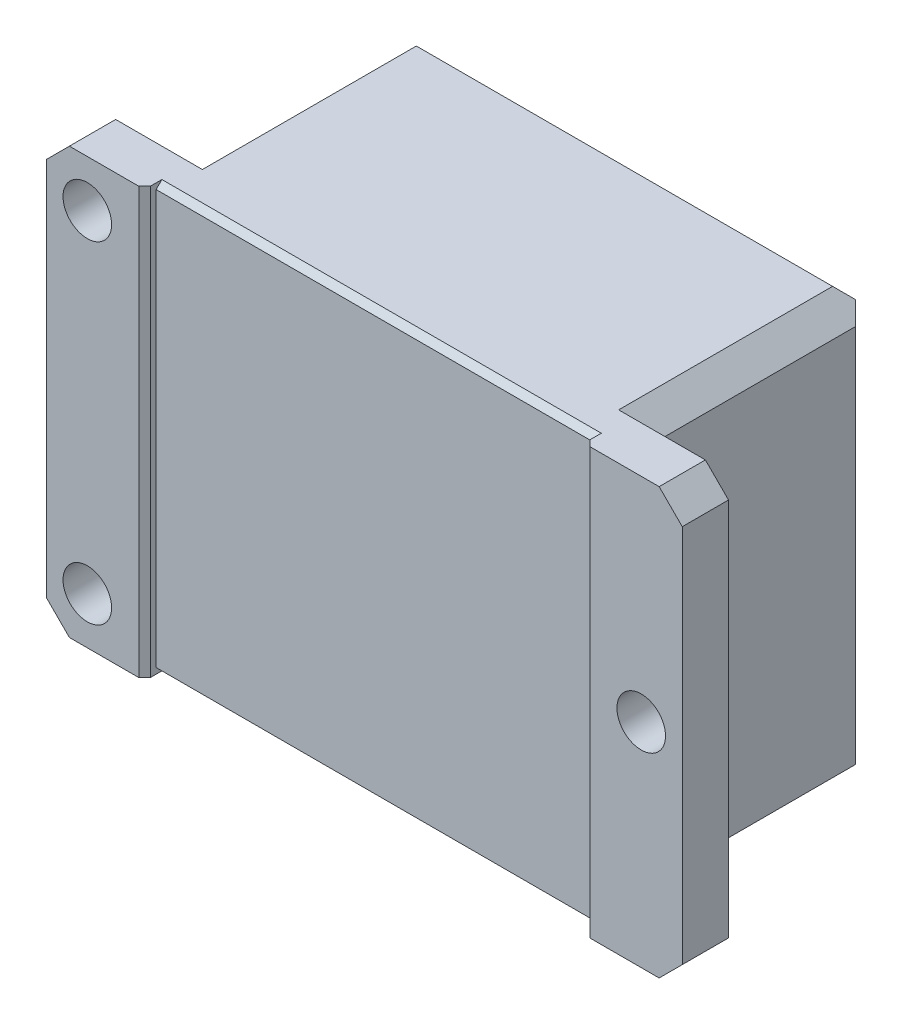
from build123d import *

# Parameters (mm, degrees)
SKETCH_1_W          = 55
SKETCH_1_H          = 36.8
EXTRUDE_1_DEPTH     = 24
SKETCH_2_W          = 38
SKETCH_2_H          = 36.8
CUT_EXTRUDE_1_DEPTH = 1
CHAMFER_1_SIZE      = 0.5
CHAMFER_2_SIZE      = 0.5
SKETCH_3_W          = 7.5
SKETCH_3_H          = 36.8
CUT_EXTRUDE_2_DEPTH = 20
CHAMFER_3_SIZE      = 1.5
CHAMFER_4_SIZE      = 2
CHAMFER_5_SIZE      = 2
SKETCH_4_R          = 2.1
CUT_EXTRUDE_3_DEPTH = 20
SKETCH_5_R          = 5
EXTRUDE_2_DEPTH     = 10


with BuildPart() as part:
    # 草图1 → 凸台-拉伸1 (new body)
    with BuildSketch(Plane.XY):
        with Locations((-27.5, 18.4)):
            Rectangle(SKETCH_1_W, SKETCH_1_H)
    extrude(amount=EXTRUDE_1_DEPTH)

    # 草图2 → 切除-拉伸1 (cut)
    with BuildSketch(Plane.XY.offset(24)):
        with Locations((-27.5, 18.4)):
            Rectangle(SKETCH_2_W, SKETCH_2_H)
    extrude(amount=-CUT_EXTRUDE_1_DEPTH, mode=Mode.SUBTRACT)

    # 倒角1
    chamfer_1_edges = [part.edges().sort_by_distance(p)[0] for p in [
        (-46.5, 18.4, 24),
        (-8.5, 18.4, 24),
    ]]
    chamfer(chamfer_1_edges, length=CHAMFER_1_SIZE)

    # 倒角2
    chamfer_2_edges = [part.edges().sort_by_distance(p)[0] for p in [
        (-27.5, 36.8, 23),
        (-27.5, 0, 23),
    ]]
    chamfer(chamfer_2_edges, length=CHAMFER_2_SIZE)

    # 草图3 → 切除-拉伸2 (cut)
    with BuildSketch(Plane(origin=(0, 0, 0), x_dir=(-1, 0, 0), z_dir=(0, 0, -1))):
        with Locations((3.75, 18.4)):
            Rectangle(SKETCH_3_W, SKETCH_3_H)
        with Locations((51.25, 18.4)):
            Rectangle(SKETCH_3_W, SKETCH_3_H)
    extrude(amount=-CUT_EXTRUDE_2_DEPTH, mode=Mode.SUBTRACT)

    # 倒角3
    chamfer_3_edges = [part.edges().sort_by_distance(p)[0] for p in [
        (-27.5, 0, 0),
        (-27.5, 36.8, 0),
        (-7.5, 18.4, 0),
        (-47.5, 18.4, 0),
    ]]
    chamfer(chamfer_3_edges, length=CHAMFER_3_SIZE)

    # 倒角4
    chamfer_4_edges = [part.edges().sort_by_distance(p)[0] for p in [
        (-7.5, 36.8, 10.75),
        (-7.5, 0, 10.75),
        (-47.5, 0, 10.75),
        (-47.5, 36.8, 10.75),
    ]]
    chamfer(chamfer_4_edges, length=CHAMFER_4_SIZE)

    # 倒角5
    chamfer_5_edges = [part.edges().sort_by_distance(p)[0] for p in [
        (0, 0, 22),
        (-55, 0, 22),
        (-55, 36.8, 22),
        (0, 36.8, 22),
    ]]
    chamfer(chamfer_5_edges, length=CHAMFER_5_SIZE)

    # 草图4 → 切除-拉伸3 (cut)
    with BuildSketch(Plane(origin=(0, 0, 20), x_dir=(-1, 0, 0), z_dir=(0, 0, -1))):
        with Locations((3.55, 18.4)):
            Circle(SKETCH_4_R)
        with Locations((51.45, 32.75)):
            Circle(SKETCH_4_R)
        with Locations((51.45, 4.05)):
            Circle(SKETCH_4_R)
    extrude(amount=-CUT_EXTRUDE_3_DEPTH, mode=Mode.SUBTRACT)

    # 草图5 → 凸台-拉伸2 (add)
    with BuildSketch(Plane.ZY.offset(47.5)):
        with Locations(Location((10, 18.4, 0), (0, 0, 90))):
            Circle(SKETCH_5_R)
    extrude(amount=EXTRUDE_2_DEPTH)


solid = part.part
